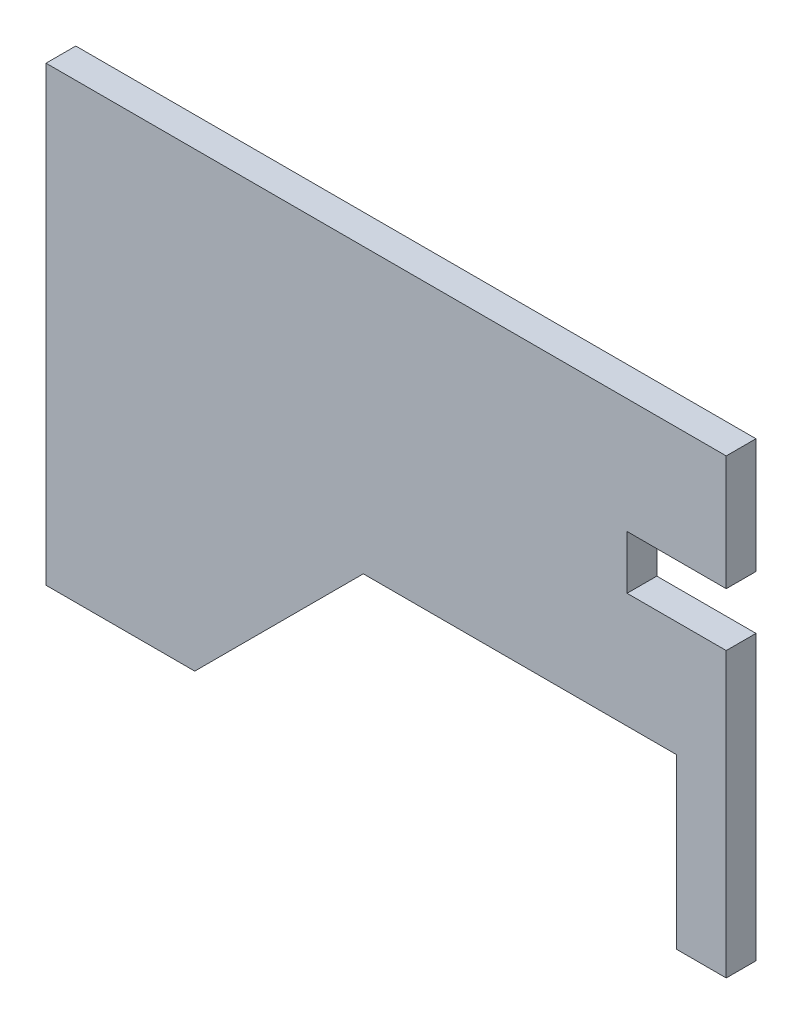
from build123d import *

# Parameters (mm, degrees)
BOSS_EXTRUDE2_DEPTH = 2.4
BOSS_EXTRUDE3_DEPTH = 3
SKETCH4_W           = 52
SKETCH4_H           = 2
CUT_EXTRUDE1_DEPTH  = 2.4


with BuildPart() as part:
    # Sketch1 → Boss-Extrude2 (new body)
    with BuildSketch(Plane.XY):
        Polygon((-26, -11), (36, -11), (36, -6), (26, -6), (26, -4.6), (23, -4.6), (23, -1), (26, -1), (26, 1), (23, 1), (23, 4.6), (26, 4.6), (26, 6), (36, 6), (36, 11), (-26, 11), (-26, 4.6), (-23, 4.6), (-23, 1), (-26, 1), (-26, -1), (-23, -1), (-23, -4.6), (-26, -4.6), align=None)
    extrude(amount=BOSS_EXTRUDE2_DEPTH)

    # Sketch3 → Boss-Extrude3 (add)
    with BuildSketch(Plane.XY.offset(2.4)):
        Polygon((-29.3, -14.3), (-29.3, -31.3), (-14.3, -31.3), (2.7, -14.3), (34.3, -14.3), (34.3, -31.3), (39.3, -31.3), (39.3, -14.3), (39.3, -2.7), (29.3, -2.7), (29.3, 2.7), (39.3, 2.7), (39.3, 14.3), (29.3, 14.3), (-29.3, 14.3), align=None)
    extrude(amount=BOSS_EXTRUDE3_DEPTH)

    # Sketch4 → Cut-Extrude1 (cut)
    with BuildSketch(Plane(origin=(0, 0, 0), x_dir=(-1, 0, 0), z_dir=(0, 0, -1))):
        Rectangle(SKETCH4_W, SKETCH4_H)
    extrude(amount=-CUT_EXTRUDE1_DEPTH, mode=Mode.SUBTRACT)


solid = part.part
